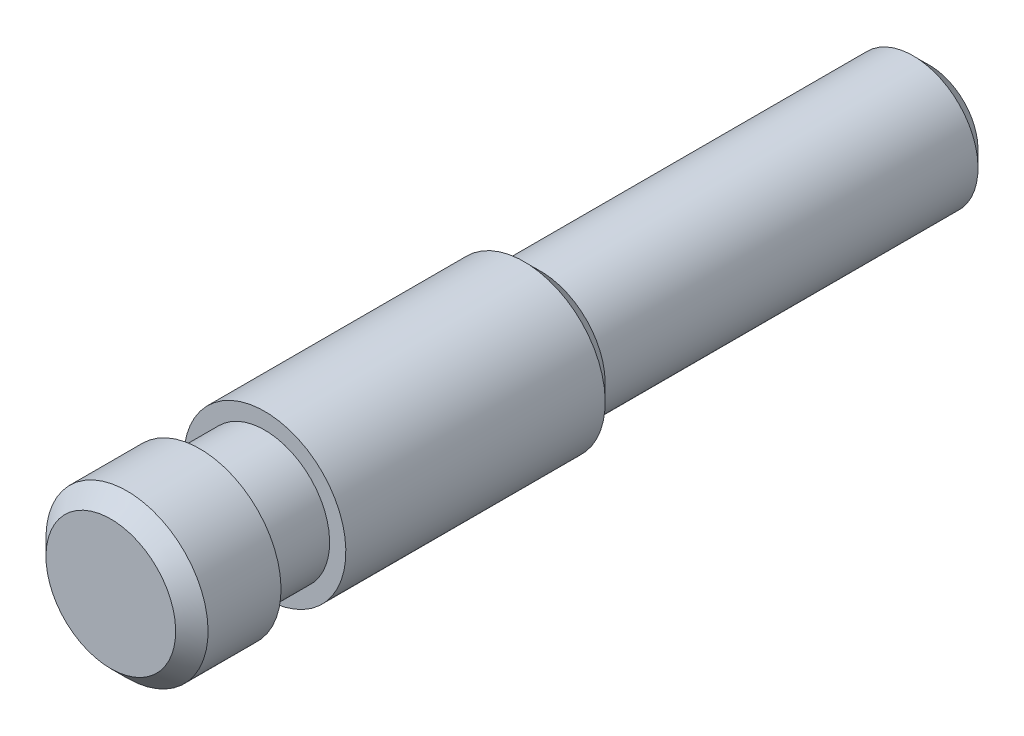
from build123d import *


with BuildPart() as part:
    # Esquisse1 → Révolution1 (revolve)
    with BuildSketch(Plane(origin=(0, 0, 0), x_dir=(0, 0, -1), z_dir=(1, 0, 0)), mode=Mode.PRIVATE) as r_volution1_sk:
        Polygon((11, 4), (-12, 4), (-13, 5), (-29, 5), (-29, 4), (-33, 4), (-33, 5), (-37.5, 5), (-38.5, 4), (-38.5, 0), (12, 0), (12, 3), align=None)
    revolve(r_volution1_sk.sketch.rotate(Axis((0, 0, 38.5), (0, 0, -1)), 180), axis=Axis((0, 0, 38.5), (0, 0, -1)))


solid = part.part
